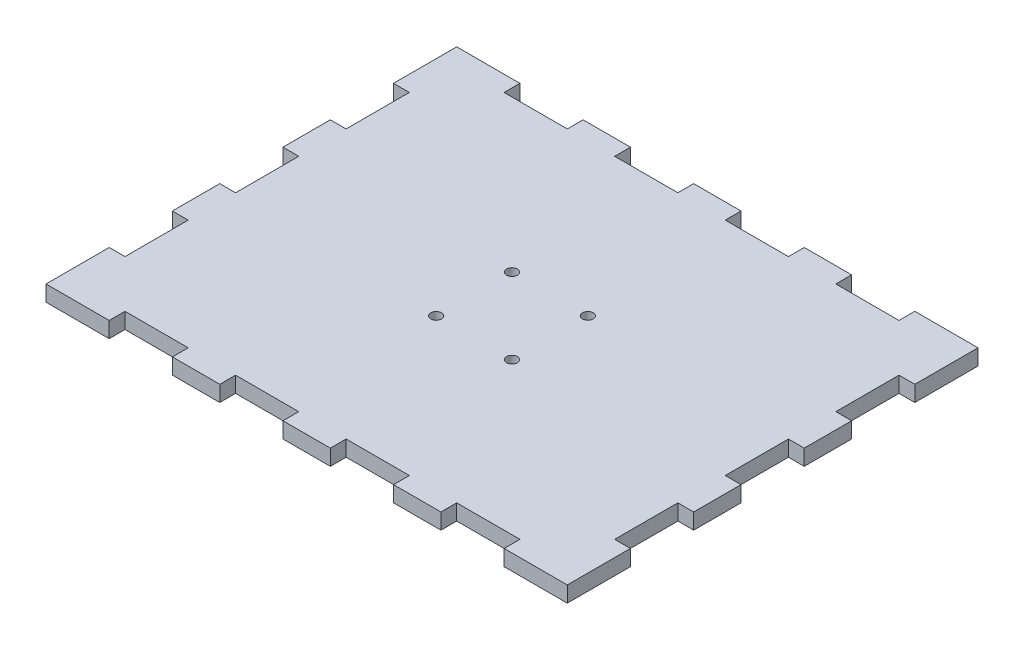
from build123d import *

# Parameters (mm, degrees)
BOSS_EXTRUDE1_DEPTH = 5
SKETCH2_R           = 1.7
CUT_EXTRUDE1_DEPTH  = 10


with BuildPart() as part:
    # Sketch1 → Boss-Extrude1 (new body)
    with BuildSketch(Plane(origin=(0, 0, 0), x_dir=(1, 0, 0), z_dir=(0, 1, 0))):
        Polygon((-82.5, 60), (-82.5, 65), (-77.5, 65), (-62.5, 65), (-62.5, 60), (-42.5, 60), (-42.5, 65), (-27.5, 65), (-27.5, 60), (-7.5, 60), (-7.5, 65), (7.5, 65), (7.5, 60), (27.5, 60), (27.5, 65), (42.5, 65), (42.5, 60), (62.5, 60), (62.5, 65), (77.5, 65), (82.5, 65), (82.5, 60), (82.5, 45), (77.5, 45), (77.5, 25), (82.5, 25), (82.5, 10), (77.5, 10), (77.5, -10), (82.5, -10), (82.5, -25), (77.5, -25), (77.5, -45), (82.5, -45), (82.5, -60), (82.5, -65), (77.5, -65), (62.5, -65), (62.5, -60), (42.5, -60), (42.5, -65), (27.5, -65), (27.5, -60), (7.5, -60), (7.5, -65), (-7.5, -65), (-7.5, -60), (-27.5, -60), (-27.5, -65), (-42.5, -65), (-42.5, -60), (-62.5, -60), (-62.5, -65), (-77.5, -65), (-82.5, -65), (-82.5, -60), (-82.5, -45), (-77.5, -45), (-77.5, -25), (-82.5, -25), (-82.5, -10), (-77.5, -10), (-77.5, 10), (-82.5, 10), (-82.5, 25), (-77.5, 25), (-77.5, 45), (-82.5, 45), align=None)
    extrude(amount=BOSS_EXTRUDE1_DEPTH)

    # Sketch2 → Cut-Extrude1 (cut)
    with BuildSketch(Plane(origin=(0, 5, 0), x_dir=(1, 0, 0), z_dir=(0, 1, 0))):
        with Locations(Location((-11.999998057, -11.999998057, 0), (0, 0, 270))):
            Circle(SKETCH2_R)
        with Locations(Location((-11.999998057, 11.999998057, 0), (0, 0, 270))):
            Circle(SKETCH2_R)
        with Locations(Location((11.999998057, 11.999998057, 0), (0, 0, 270))):
            Circle(SKETCH2_R)
        with Locations(Location((11.999998057, -11.999998057, 0), (0, 0, 270))):
            Circle(SKETCH2_R)
    extrude(amount=-CUT_EXTRUDE1_DEPTH, mode=Mode.SUBTRACT)


solid = part.part
